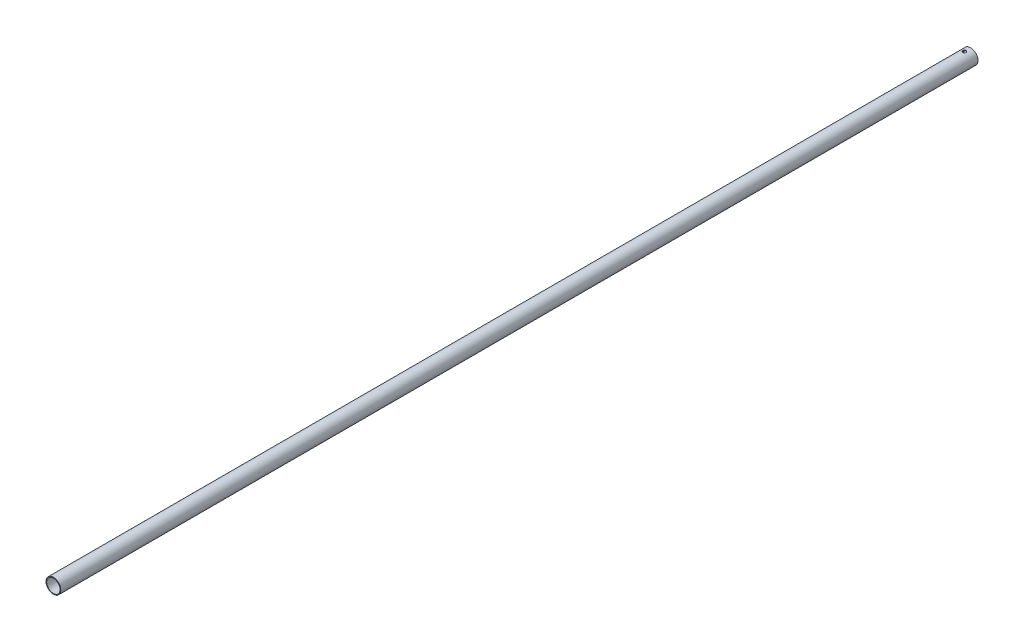
from build123d import *

# Parameters (mm, degrees)
SKETCH1_R               = 14.732
SKETCH1_R_2             = 13.3096
EXTRUDE1_DEPTH          = 1828.8
F_1_4_CLEARANCE_HOLE2_D = 6.7564


with BuildPart() as part:
    # Sketch1 → Extrude1 (new body)
    with BuildSketch(Plane.XY):
        with Locations(Location((0, 0, 0), (0, 0, 180))):
            Circle(SKETCH1_R)
        with Locations(Location((0, 0, 0), (0, 0, 180))):
            Circle(SKETCH1_R_2, mode=Mode.SUBTRACT)
    extrude(amount=EXTRUDE1_DEPTH)

    # 1/4 Clearance Hole2 (through all)
    with Locations(Plane(origin=(0, -14.732, 914.4), x_dir=(-1, 0, 0), z_dir=(0, -1, 0))):
        with Locations((0, 901.7)):
            Hole(F_1_4_CLEARANCE_HOLE2_D / 2)


solid = part.part
